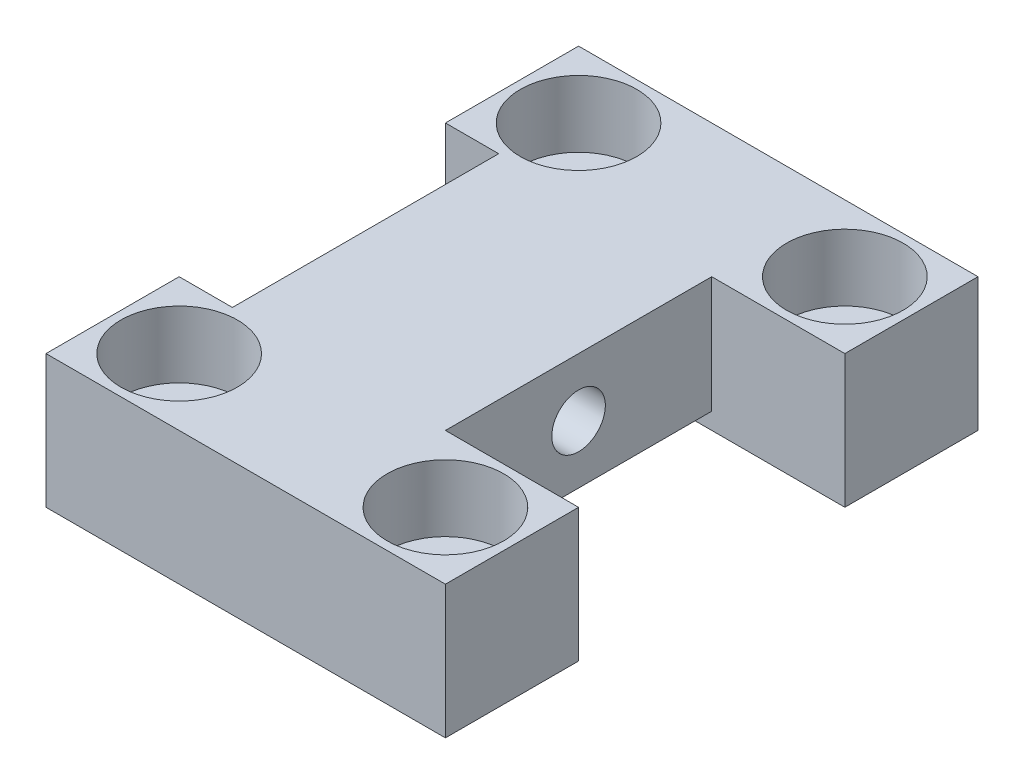
from build123d import *

# Parameters (mm, degrees)
SKETCH1_W                                        = 38.1
SKETCH1_H                                        = 50.8
EXTRUDE1_DEPTH                                   = 12.7
CBORE_FOR_1_4_SOCKET_HEAD_CAP_SCREW1_D           = 6.7564
CBORE_FOR_1_4_SOCKET_HEAD_CAP_SCREW1_CBORE_D     = 11.1125
CBORE_FOR_1_4_SOCKET_HEAD_CAP_SCREW1_CBORE_DEPTH = 6.35
SKETCH3_W                                        = 5.08
SKETCH3_H                                        = 25.4
SKETCH3_W_2                                      = 12.7
CUT_EXTRUDE2_DEPTH                               = 35.195796525
SKETCH5_W                                        = 20.32
SKETCH5_H                                        = 25.4
CUT_EXTRUDE4_DEPTH                               = 1.5875
F_1_4_20_TAPPED_HOLE1_D                          = 5.1054


with BuildPart() as part:
    # Sketch1 → Extrude1 (new body)
    with BuildSketch(Plane(origin=(0, 0, 0), x_dir=(1, 0, 0), z_dir=(0, 1, 0))):
        Rectangle(SKETCH1_W, SKETCH1_H)
    extrude(amount=EXTRUDE1_DEPTH)

    # CBORE for 1/4 Socket Head Cap Screw1 (through all)
    with Locations(Plane(origin=(0, 12.7, 0), x_dir=(-1, 0, 0), z_dir=(0, 1, 0))):
        with Locations((12.7, -19.05), (-12.7, -19.05), (-12.7, 19.05), (12.7, 19.05)):
            CounterBoreHole(CBORE_FOR_1_4_SOCKET_HEAD_CAP_SCREW1_D / 2, CBORE_FOR_1_4_SOCKET_HEAD_CAP_SCREW1_CBORE_D / 2, CBORE_FOR_1_4_SOCKET_HEAD_CAP_SCREW1_CBORE_DEPTH)

    # Sketch3 → Cut-Extrude2 (cut, through all)
    with BuildSketch(Plane(origin=(0, 12.7, 0), x_dir=(-1, 0, 0), z_dir=(0, 1, 0))):
        with Locations((16.51, 0)):
            Rectangle(SKETCH3_W, SKETCH3_H)
        with Locations((-12.7, 0)):
            Rectangle(SKETCH3_W_2, SKETCH3_H)
    extrude(amount=-CUT_EXTRUDE2_DEPTH, mode=Mode.SUBTRACT)

    # Sketch5 → Cut-Extrude4 (cut)
    with BuildSketch(Plane.XZ):
        with Locations((-3.81, 0)):
            Rectangle(SKETCH5_W, SKETCH5_H)
    extrude(amount=-CUT_EXTRUDE4_DEPTH, mode=Mode.SUBTRACT)

    # 1/4-20 Tapped Hole1 (through all)
    with Locations(Plane.ZY.offset(13.97)):
        with Locations((0, 7.14375)):
            Hole(F_1_4_20_TAPPED_HOLE1_D / 2)


solid = part.part
